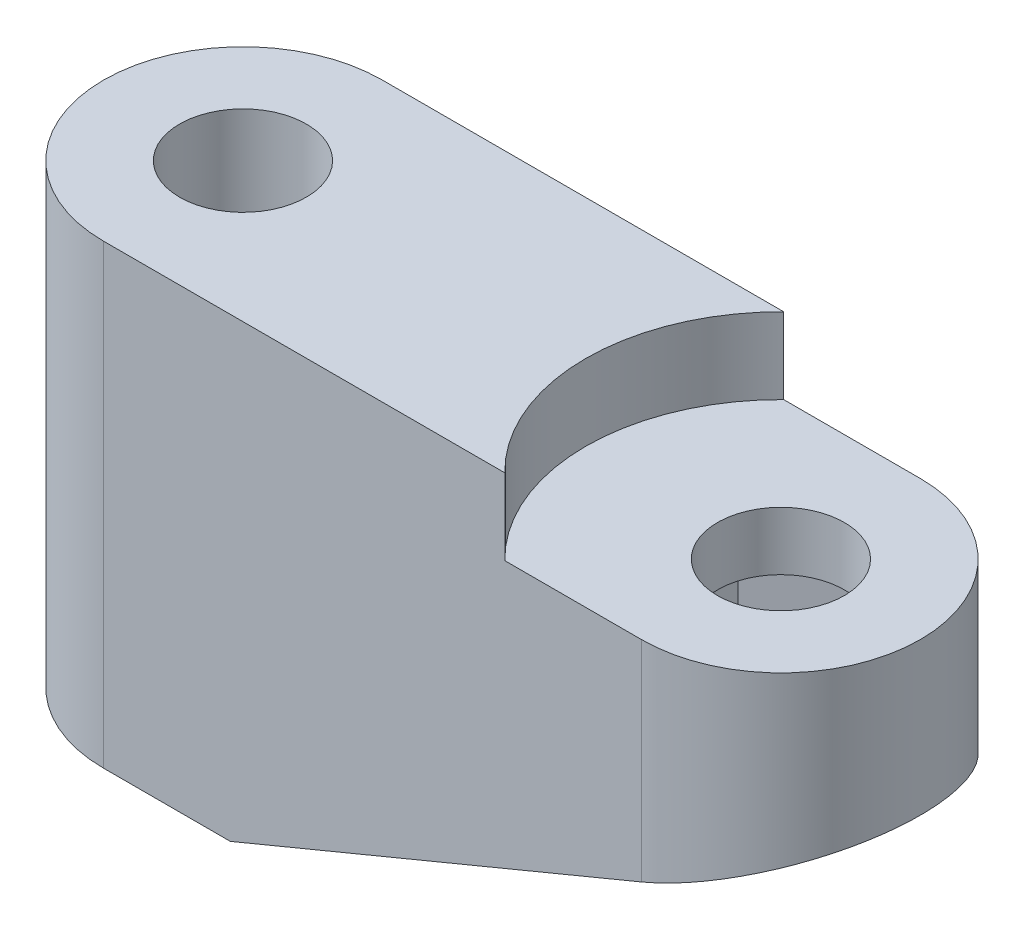
from build123d import *

# Parameters (mm, degrees)
CROQUIS1_R                 = 2.5
SALIENTE_EXTRUIR1_DEPTH    = 15
CORTAR_EXTRUIR1_DEPTH      = 15
CORTAR_EXTRUIR2_DEPTH      = 3.7
CORTAR_EXTRUIR2_DEPTH_BACK = 15
CROQUIS4_R                 = 2.5
SALIENTE_EXTRUIR2_DEPTH    = 3


with BuildPart() as part:
    # Croquis1 → Saliente-Extruir1 (new body)
    with BuildSketch(Plane(origin=(0, 0, 0), x_dir=(1, 0, 0), z_dir=(0, 1, 0))):
        with BuildLine():
            Line((0, 5.5), (21.215, 5.5))
            ThreePointArc((21.215, 5.5), (26.715, 0), (21.215, -5.5))
            Line((21.215, -5.5), (0, -5.5))
            ThreePointArc((0, -5.5), (-5.5, 0), (0, 5.5))
        make_face()
        with Locations(Location((0, 0, 0), (0, 0, 270))):
            Circle(CROQUIS1_R, mode=Mode.SUBTRACT)
        with Locations(Location((21.215, 0, 0), (0, 0, 270))):
            Circle(CROQUIS1_R, mode=Mode.SUBTRACT)
    extrude(amount=SALIENTE_EXTRUIR1_DEPTH)

    # Croquis2 → Cortar-Extruir1 (cut)
    with BuildSketch(Plane.XY.offset(5.5)):
        Polygon((5, 0), (26.715, 9), (26.715, 0), align=None)
    extrude(amount=-CORTAR_EXTRUIR1_DEPTH, mode=Mode.SUBTRACT)

    # Croquis3 → Cortar-Extruir2 (cut, two sides: drawn at the far end of the back side and taken through both)
    with BuildSketch(Plane(origin=(0, 9, 0), x_dir=(1, 0, 0), z_dir=(0, 1, 0)).offset(-CORTAR_EXTRUIR2_DEPTH_BACK)):
        Polygon((17.215, 2.309401077), (17.215, -2.309401077), (21.215, -4.618802154), (25.215, -2.309401077), (25.215, 2.309401077), (21.215, 4.618802154), align=None)
    extrude(amount=CORTAR_EXTRUIR2_DEPTH + CORTAR_EXTRUIR2_DEPTH_BACK, mode=Mode.SUBTRACT)

    # Croquis4 → Saliente-Extruir2 (add)
    with BuildSketch(Plane(origin=(0, 15, 0), x_dir=(1, 0, 0), z_dir=(0, 1, 0))):
        with BuildLine():
            Line((0, -5.5), (15.826122566, -5.5))
            ThreePointArc((15.826122566, -5.5), (13.515, 0), (15.826122566, 5.5))
            Line((15.826122566, 5.5), (0, 5.5))
            ThreePointArc((0, 5.5), (-5.5, 0), (0, -5.5))
        make_face()
        with Locations(Location((0, 0, 0), (0, 0, 270))):
            Circle(CROQUIS4_R, mode=Mode.SUBTRACT)
    extrude(amount=SALIENTE_EXTRUIR2_DEPTH)


solid = part.part
